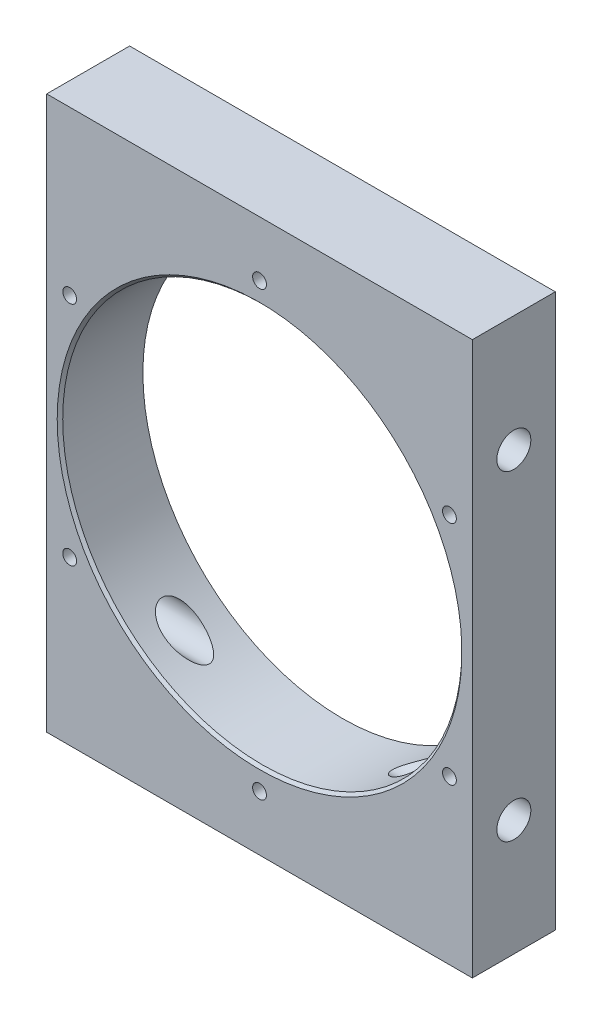
from build123d import *

# Parameters (mm, degrees)
SKIZZE1_W                       = 77
SKIZZE1_H                       = 100
AUFSATZ_LINEAR_AUSTRAGEN1_DEPTH = 7.5
SKIZZE2_R                       = 36.1
SCHNITT_LINEAR_AUSTRAGEN1_DEPTH = 65.863317831
SKIZZE3_R                       = 3.075
SCHNITT_LINEAR_AUSTRAGEN2_DEPTH = 93.115416734
FASE1_SIZE                      = 0.5
M3_GEWINDEBOHRUNG1_D            = 2.5


with BuildPart() as part:
    # Skizze1 → Aufsatz-Linear austragen1 (new, symmetric)
    with BuildSketch(Plane.XY):
        Rectangle(SKIZZE1_W, SKIZZE1_H)
    extrude(amount=AUFSATZ_LINEAR_AUSTRAGEN1_DEPTH, both=True)

    # Skizze2 → Schnitt-Linear austragen1 (cut, through all)
    with BuildSketch(Plane.XY.offset(7.5)):
        Circle(SKIZZE2_R)
    extrude(amount=-SCHNITT_LINEAR_AUSTRAGEN1_DEPTH, mode=Mode.SUBTRACT)

    # Skizze3 → Schnitt-Linear austragen2 (cut, through all)
    with BuildSketch(Plane(origin=(38.5, 0, 0), x_dir=(0, 0, -1), z_dir=(1, 0, 0))):
        with Locations((0, 29)):
            Circle(SKIZZE3_R)
        with Locations((0, -29)):
            Circle(SKIZZE3_R)
    extrude(amount=-SCHNITT_LINEAR_AUSTRAGEN2_DEPTH, mode=Mode.SUBTRACT)

    # Fase1
    fase1_edges = [part.edges().sort_by_distance(p)[0] for p in [
        (-36.1, 0, 7.5),
    ]]
    chamfer(fase1_edges, length=FASE1_SIZE)

    # M3 Gewindebohrung1 (through all)
    with Locations(Plane.XY.offset(7.5)):
        with Locations((-34.347488991, 20.5), (0, 40), (0, -40), (34.347488991, -20.5), (34.347488991, 20.5), (-34.347488991, -20.5)):
            Hole(M3_GEWINDEBOHRUNG1_D / 2)


solid = part.part
